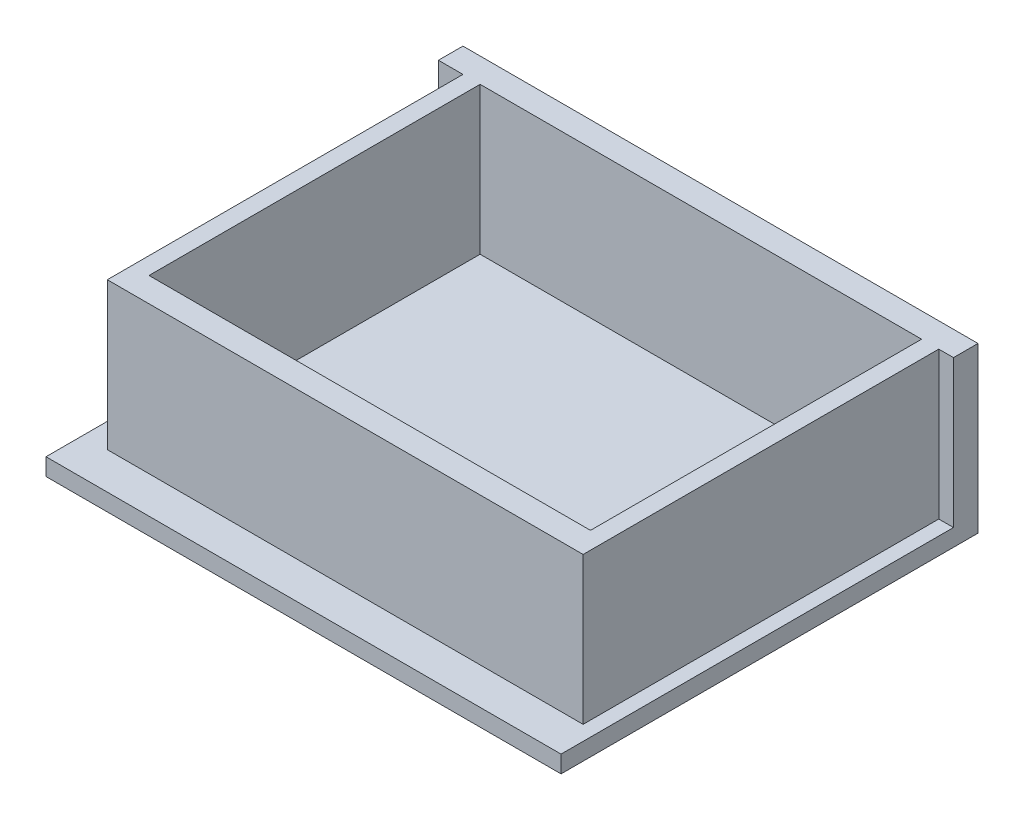
from build123d import *

# Parameters (mm, degrees)
SKETCH1_W           = 210
SKETCH1_H           = 170
BOSS_EXTRUDE1_DEPTH = 7
SKETCH2_W           = 180
SKETCH2_H           = 135
BOSS_EXTRUDE2_DEPTH = 60


with BuildPart() as part:
    # Sketch1 → Boss-Extrude1 (new body)
    with BuildSketch(Plane(origin=(0, 0, 0), x_dir=(1, 0, 0), z_dir=(0, 1, 0))):
        with Locations((105, 85)):
            Rectangle(SKETCH1_W, SKETCH1_H)
    extrude(amount=BOSS_EXTRUDE1_DEPTH)

    # Sketch2 → Boss-Extrude2 (add)
    with BuildSketch(Plane(origin=(0, 7, 0), x_dir=(1, 0, 0), z_dir=(0, 1, 0))):
        Polygon((210, 170), (0, 170), (0, 160), (10, 160), (10, 25), (10, 20.500436989), (10, 15), (204, 15), (204, 18.199432026), (204, 25), (204, 160), (210, 160), align=None)
        with Locations((107, 92.5)):
            Rectangle(SKETCH2_W, SKETCH2_H, mode=Mode.SUBTRACT)
    extrude(amount=BOSS_EXTRUDE2_DEPTH)


solid = part.part
